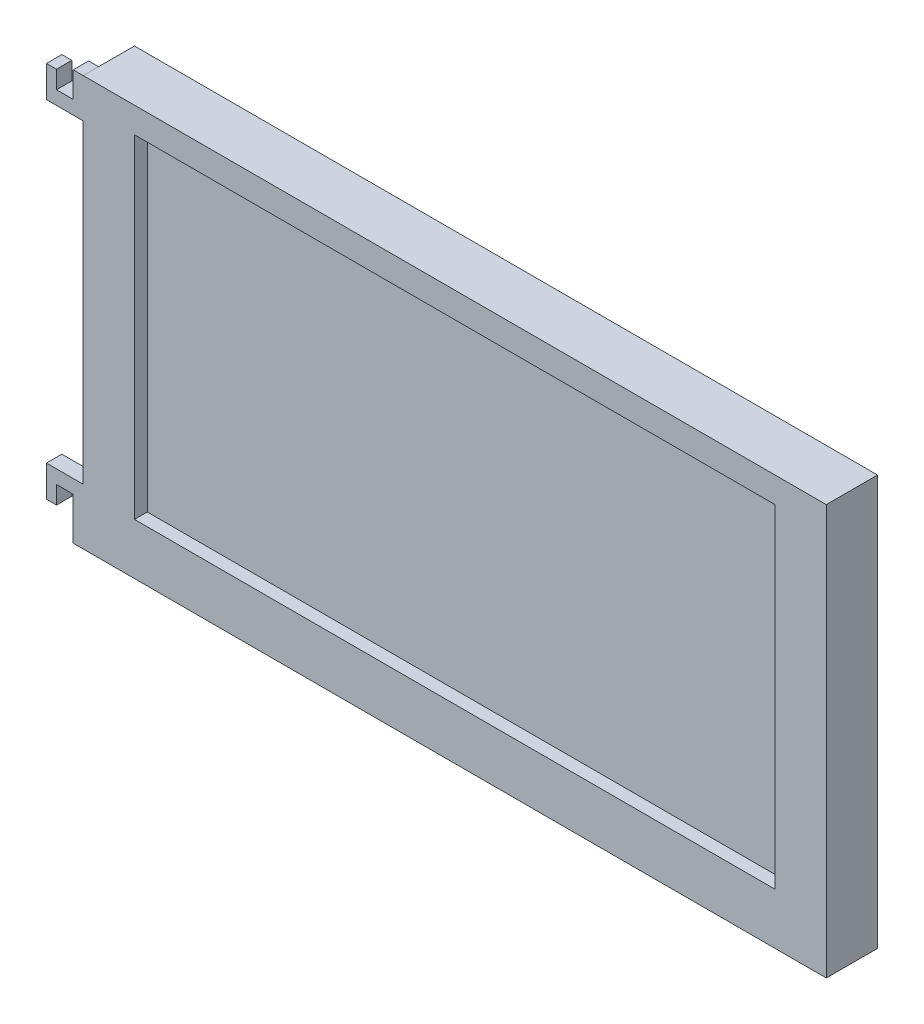
from build123d import *

# Parameters (mm, degrees)
SKETCH1_W           = 368.3
SKETCH1_H           = 203.2
BOSS_EXTRUDE1_DEPTH = 12.7
SKETCH2_W           = 317.5
SKETCH2_H           = 165.1
CUT_EXTRUDE1_DEPTH  = 6.35
BOSS_EXTRUDE3_DEPTH = 7.62
CUT_EXTRUDE2_DEPTH  = 20.32


with BuildPart() as part:
    # Sketch1 → Boss-Extrude1 (new, symmetric)
    with BuildSketch(Plane.XY):
        Rectangle(SKETCH1_W, SKETCH1_H)
    extrude(amount=BOSS_EXTRUDE1_DEPTH, both=True)

    # Sketch2 → Cut-Extrude1 (cut)
    with BuildSketch(Plane.XY.offset(12.7)):
        with Locations((0, 6.35)):
            Rectangle(SKETCH2_W, SKETCH2_H)
    extrude(amount=-CUT_EXTRUDE1_DEPTH, mode=Mode.SUBTRACT)

    # Sketch4 → Boss-Extrude3 (add)
    with BuildSketch(Plane.XY.offset(12.7)):
        Polygon((184.15, -101.6), (189.119700693, -101.6), (189.119700693, -80.560215749), (197.392455233, -80.560215749), (197.392455233, -89.3698935), (202.362155926, -89.3698935), (202.362155926, -73.820655617), (184.15, -73.820655617), align=None)
        Polygon((189.119700693, 88.9), (197.392455233, 88.9), (197.392455233, 97.709677751), (202.362155926, 97.709677751), (202.362155926, 82.160439868), (184.15, 82.160439868), (184.15, 88.012590692), (184.15, 101.584884773), (189.119700693, 101.584884773), align=None)
    boss_extrude3 = extrude(amount=-BOSS_EXTRUDE3_DEPTH)

    # Mirror2: Boss-Extrude3 across plane
    add(boss_extrude3.mirror(Plane(origin=(0, 0, 0), x_dir=(0, 0, 1), z_dir=(1, 0, 0))))

    # Sketch5 → Cut-Extrude2 (cut)
    with BuildSketch(Plane.XY.offset(12.7)):
        Polygon((202.362155926, -73.820655617), (184.15, -73.820655617), (184.15, -101.6), (189.119700693, -101.6), (189.119700693, -80.560215749), (197.392455233, -80.560215749), (197.392455233, -89.3698935), (202.362155926, -89.3698935), align=None)
        Polygon((184.15, 101.584884773), (184.15, 82.160439868), (202.362155926, 82.160439868), (202.362155926, 97.709677751), (197.392455233, 97.709677751), (197.392455233, 88.9), (189.119700693, 88.9), (189.119700693, 101.584884773), align=None)
    extrude(amount=-CUT_EXTRUDE2_DEPTH, mode=Mode.SUBTRACT)


solid = part.part
